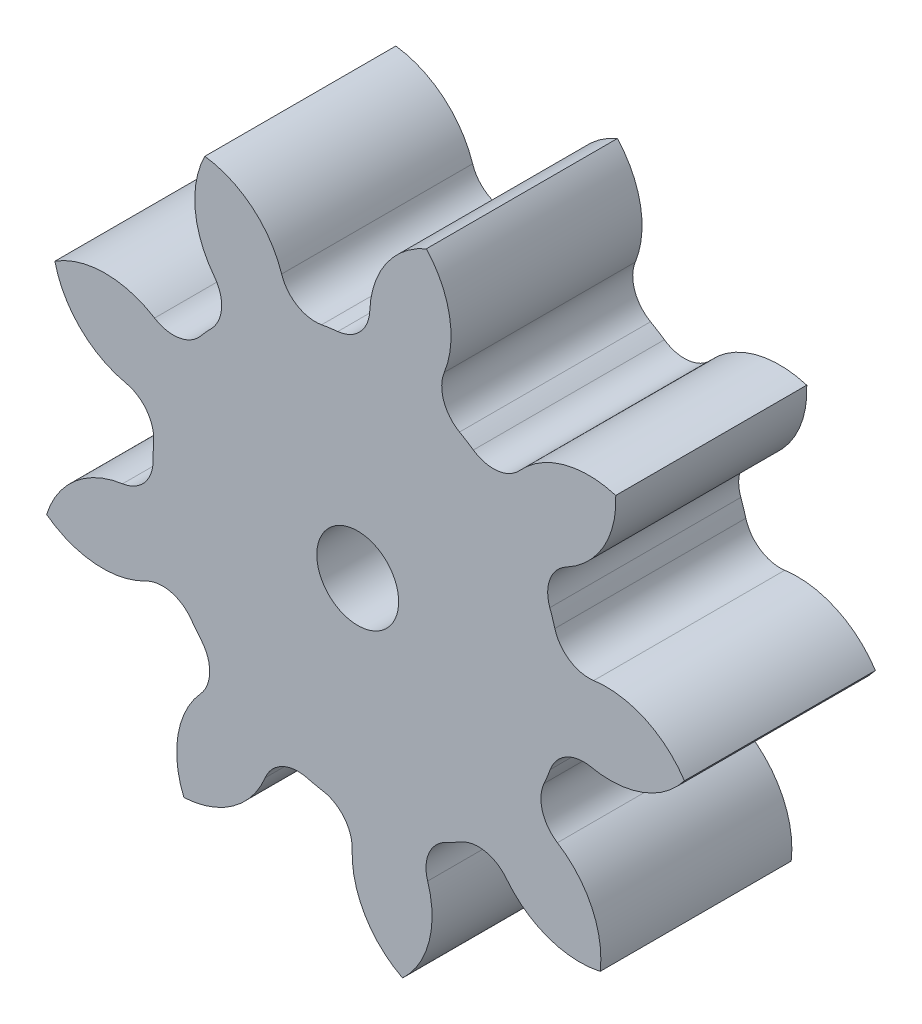
from build123d import *

# Parameters (mm, degrees)
CROQUIS1_R              = 12
CROQUIS1_R_2            = 10
CROQUIS1_R_3            = 3
CROQUIS1_R_4            = 1.5
SALIENTE_EXTRUIR1_DEPTH = 7
CORTAR_EXTRUIR2_DEPTH   = 7
MATRIZC2_COUNT          = 9
CROQUIS3_R              = 1.5
CORTAR_EXTRUIR3_DEPTH   = 7
CROQUIS7_R              = 3
CORTAR_EXTRUIR4_DEPTH   = 4.5


with BuildPart() as part:
    # Croquis1 → Saliente-Extruir1 (new body)
    # profile 1 of 4: a face of its own
    with BuildSketch(Plane(origin=(0, 0, 0), x_dir=(0, 1, 0), z_dir=(0, 0, 1))):
        with Locations(Location((0, 0, 0), (0, 0, 90))):
            Circle(CROQUIS1_R)
        Circle(CROQUIS1_R_2, mode=Mode.SUBTRACT)
    # profile 2 of 4: a face of its own
    with BuildSketch(Plane(origin=(0, 0, 0), x_dir=(0, 1, 0), z_dir=(0, 0, 1))):
        Circle(CROQUIS1_R_2)
        Circle(CROQUIS1_R_3, mode=Mode.SUBTRACT)
    # profile 3 of 4: a face of its own
    with BuildSketch(Plane(origin=(0, 0, 0), x_dir=(0, 1, 0), z_dir=(0, 0, 1))):
        Circle(CROQUIS1_R_3)
        Circle(CROQUIS1_R_4, mode=Mode.SUBTRACT)
    # profile 4 of 4: a face of its own
    with BuildSketch(Plane(origin=(0, 0, 0), x_dir=(0, 1, 0), z_dir=(0, 0, 1))):
        Circle(CROQUIS1_R_4)
    extrude(amount=SALIENTE_EXTRUIR1_DEPTH)

    # Croquis2 → Cortar-Extruir2 (cut)
    with BuildSketch(Plane(origin=(0, 0, 0), x_dir=(-1, 0, 0), z_dir=(0, 0, -1))):
        with BuildLine():
            ThreePointArc((-1.671726175, -11.882984961), (2.52, -11.732416631), (6.40384449, -10.148437108))
            ThreePointArc((6.40384449, -10.148437108), (4.588589795, -9.529007631), (3.392213046, -8.029832803))
            ThreePointArc((3.392213046, -8.029832803), (2.772460995, -7.361306204), (1.866050022, -7.264148767))
            ThreePointArc((1.866050022, -7.264148767), (1.575, -7.332760394), (1.281446283, -7.389715517))
            ThreePointArc((1.281446283, -7.389715517), (0.494876961, -7.850507358), (0.204307181, -8.714561536))
            ThreePointArc((0.204307181, -8.714561536), (-0.270936109, -10.57278281), (-1.671726175, -11.882984961))
        make_face()
    cortar_extruir2 = extrude(amount=-CORTAR_EXTRUIR2_DEPTH, mode=Mode.SUBTRACT)

    # MatrizC2: Cortar-Extruir2 ×9 about axis
    matrizc2_axis = Axis((0, 0, 0), (0, 0, 1))
    for i in range(1, MATRIZC2_COUNT):
        add(cortar_extruir2.rotate(matrizc2_axis, i * 360 / MATRIZC2_COUNT), mode=Mode.SUBTRACT)

    # Croquis3 → Cortar-Extruir3 (cut)
    with BuildSketch(Plane(origin=(0, 0, 0), x_dir=(-1, 0, 0), z_dir=(0, 0, -1))):
        Circle(CROQUIS3_R)
    extrude(amount=-CORTAR_EXTRUIR3_DEPTH, mode=Mode.SUBTRACT)

    # Croquis7 → Cortar-Extruir4 (cut)
    with BuildSketch(Plane(origin=(0, 0, 0), x_dir=(-1, 0, 0), z_dir=(0, 0, -1))):
        Circle(CROQUIS7_R)
    extrude(amount=-CORTAR_EXTRUIR4_DEPTH, mode=Mode.SUBTRACT)


solid = part.part
